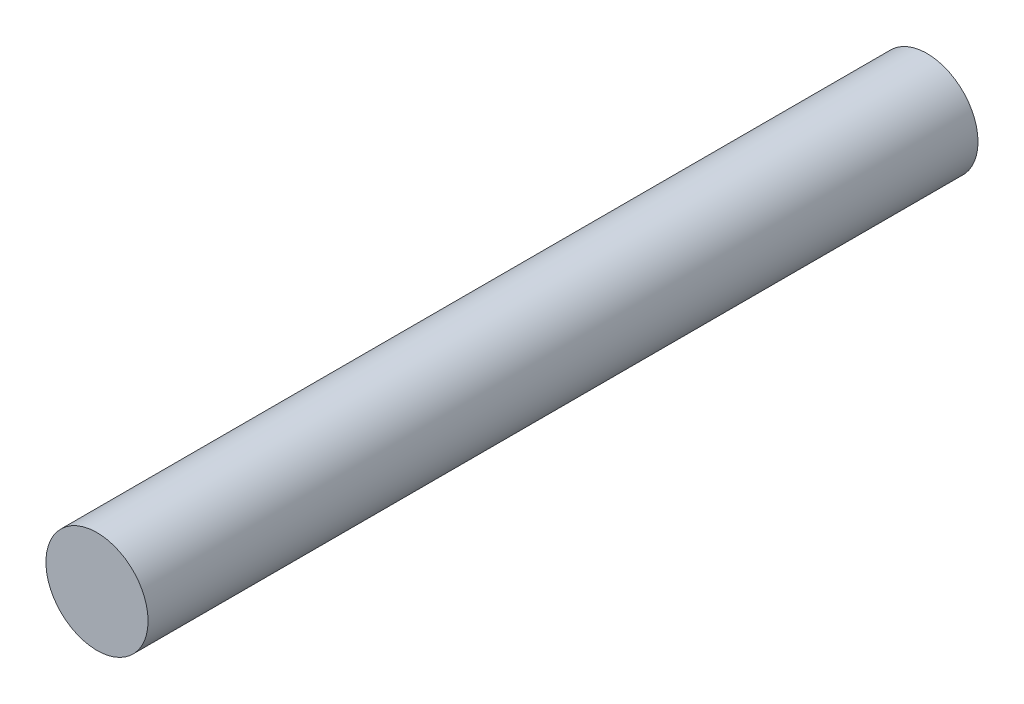
from build123d import *

# Parameters (mm, degrees)
SKETCH1_R           = 4
BOSS_EXTRUDE1_DEPTH = 65


with BuildPart() as part:
    # Sketch1 → Boss-Extrude1 (new body)
    with BuildSketch(Plane.XY):
        Circle(SKETCH1_R)
    extrude(amount=BOSS_EXTRUDE1_DEPTH)


solid = part.part
